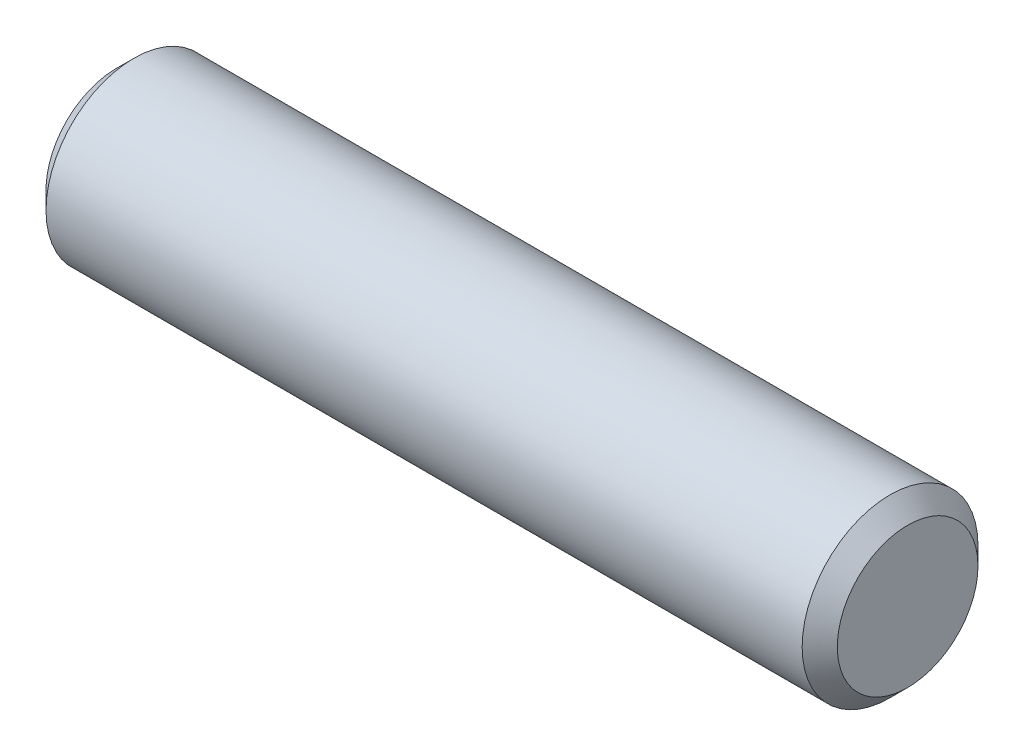
from build123d import *

# Parameters (mm, degrees)
EXTRUDE1_DEPTH      = 14.2875
EXTRUDE1_DEPTH_BACK = 14.2875
SKETCH2_R           = 3.175
CHAMFER1_SIZE       = 0.635


with BuildPart() as part:
    # Sketch2 → Extrude1 (new, two sides: drawn at the far end of the back side and taken through both)
    with BuildSketch(Plane(origin=(0, 0, 0), x_dir=(0, 0, -1), z_dir=(1, 0, 0)).offset(-EXTRUDE1_DEPTH_BACK)):
        Circle(SKETCH2_R)
    extrude(amount=EXTRUDE1_DEPTH + EXTRUDE1_DEPTH_BACK)

    # Chamfer1
    chamfer1_edges = [part.edges().sort_by_distance(p)[0] for p in [
        (-14.2875, 0, 3.175),
        (14.2875, 0, 3.175),
    ]]
    chamfer(chamfer1_edges, length=CHAMFER1_SIZE)


solid = part.part
